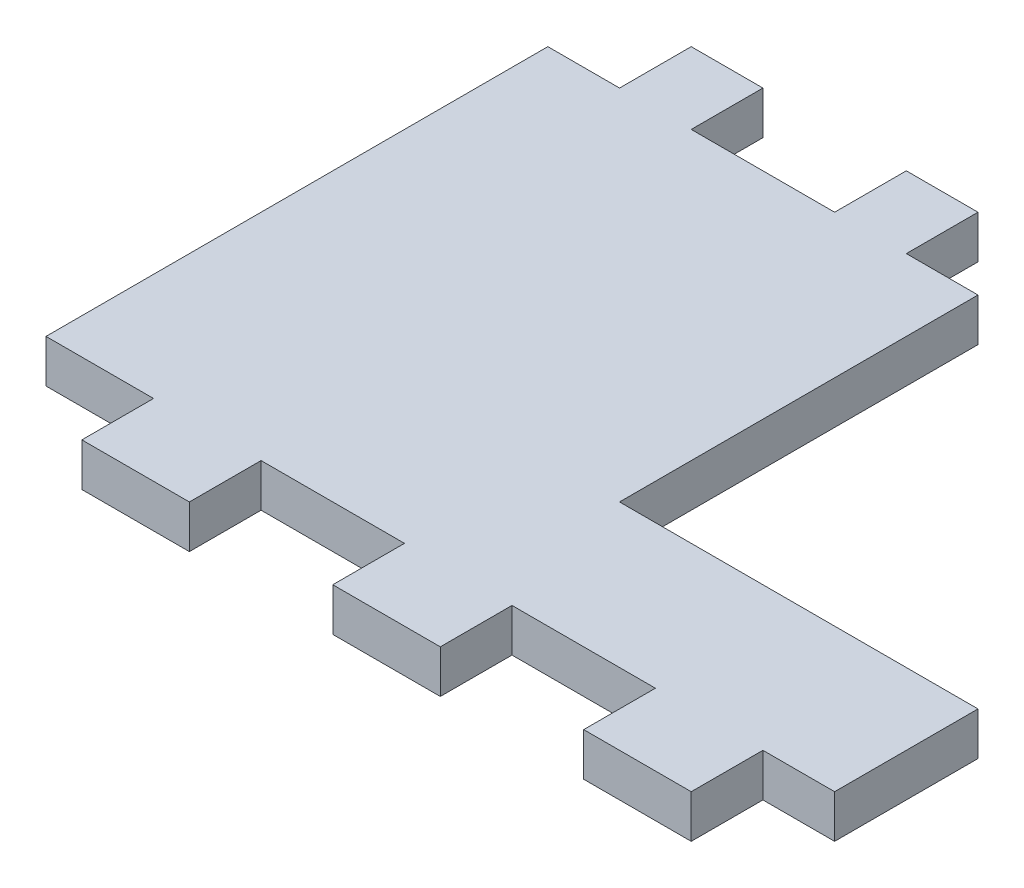
from build123d import *

# Parameters (mm, degrees)
BOSS_EXTRUDE1_DEPTH = 3


with BuildPart() as part:
    # Sketch1 → Boss-Extrude1 (new body)
    with BuildSketch(Plane(origin=(0, 0, 0), x_dir=(1, 0, 0), z_dir=(0, 1, 0))):
        Polygon((-40.960576752, -36.886729579), (-30.960576752, -36.886729579), (-30.960576752, -41.886729579), (-23.460576752, -41.886729579), (-23.460576752, -36.886729579), (-18.460576752, -36.886729579), (-18.460576752, -26.886729579), (-43.460576752, -26.886729579), (-43.460576752, -1.886729579), (-48.460576752, -1.886729579), (-48.460576752, 3.113270421), (-53.460576752, 3.113270421), (-53.460576752, -1.886729579), (-63.460576752, -1.886729579), (-63.460576752, 3.113270421), (-68.460576752, 3.113270421), (-68.460576752, -1.886729579), (-73.460576752, -1.886729579), (-73.460576752, -36.886729579), (-65.960576752, -36.886729579), (-65.960576752, -41.886729579), (-58.460576752, -41.886729579), (-58.460576752, -36.886729579), (-48.460576752, -36.886729579), (-48.460576752, -41.886729579), (-40.960576752, -41.886729579), align=None)
    extrude(amount=BOSS_EXTRUDE1_DEPTH)


solid = part.part
